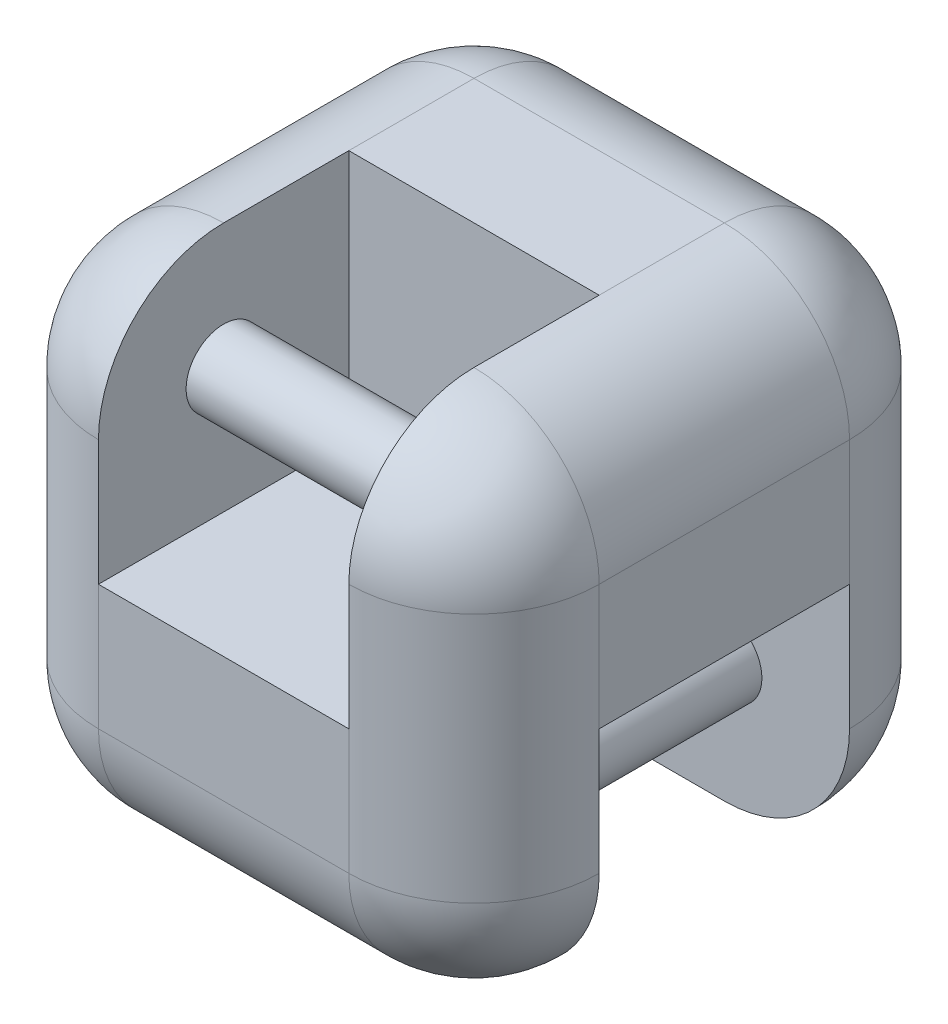
from build123d import *

# Parameters (mm, degrees)
SKETCH_1_W          = 20
SKETCH_1_H          = 20
EXTRUDE_1_DEPTH     = 20
FILLET_1_R          = 5
SKETCH_2_W          = 10
SKETCH_2_H          = 10
CUT_EXTRUDE_1_DEPTH = 10
SKETCH_3_W          = 10
SKETCH_3_H          = 10
CUT_EXTRUDE_2_DEPTH = 10
SKETCH_4_R          = 1.5
EXTRUDE_2_DEPTH     = 10
SKETCH_5_R          = 1.5
EXTRUDE_3_DEPTH     = 10


with BuildPart() as part:
    # 草图1 → 凸台-拉伸1 (new body)
    with BuildSketch(Plane.XY):
        with Locations((-13.408142688, 27.165559881)):
            Rectangle(SKETCH_1_W, SKETCH_1_H)
    extrude(amount=EXTRUDE_1_DEPTH)

    # 圆角1
    fillet_1_edges = [part.edges().sort_by_distance(p)[0] for p in [
        (-3.408142688, 27.165559881, 20),
        (-13.408142688, 37.165559881, 20),
        (-23.408142688, 27.165559881, 20),
        (-13.408142688, 37.165559881, 0),
        (-3.408142688, 27.165559881, 0),
        (-13.408142688, 17.165559881, 0),
        (-23.408142688, 27.165559881, 0),
        (-13.408142688, 17.165559881, 20),
        (-23.408142688, 37.165559881, 10),
        (-3.408142688, 37.165559881, 10),
        (-3.408142688, 17.165559881, 10),
        (-23.408142688, 17.165559881, 10),
    ]]
    fillet(fillet_1_edges, radius=FILLET_1_R)

    # 草图2 → 切除-拉伸1 (cut)
    with BuildSketch(Plane.ZY.offset(8.408142688)):
        with Locations((15, 32.165559881)):
            Rectangle(SKETCH_2_W, SKETCH_2_H)
    extrude(amount=CUT_EXTRUDE_1_DEPTH, mode=Mode.SUBTRACT)

    # 草图3 → 切除-拉伸2 (cut)
    with BuildSketch(Plane.XY.offset(5)):
        with Locations((-8.408142688, 22.165559881)):
            Rectangle(SKETCH_3_W, SKETCH_3_H)
    extrude(amount=CUT_EXTRUDE_2_DEPTH, mode=Mode.SUBTRACT)


with BuildPart() as body_2:
    # 草图4 → 凸台-拉伸2 (new body)
    with BuildSketch(Plane.ZY.offset(8.408142688)):
        with Locations((15, 32.165559881)):
            Circle(SKETCH_4_R)
    extrude(amount=EXTRUDE_2_DEPTH)


with BuildPart() as body_3:
    # 草图5 → 凸台-拉伸3 (new body)
    with BuildSketch(Plane.XY.offset(5)):
        with Locations((-8.408142688, 22.165559881)):
            Circle(SKETCH_5_R)
    extrude(amount=EXTRUDE_3_DEPTH)


solid = Compound([part.part, body_2.part, body_3.part])
